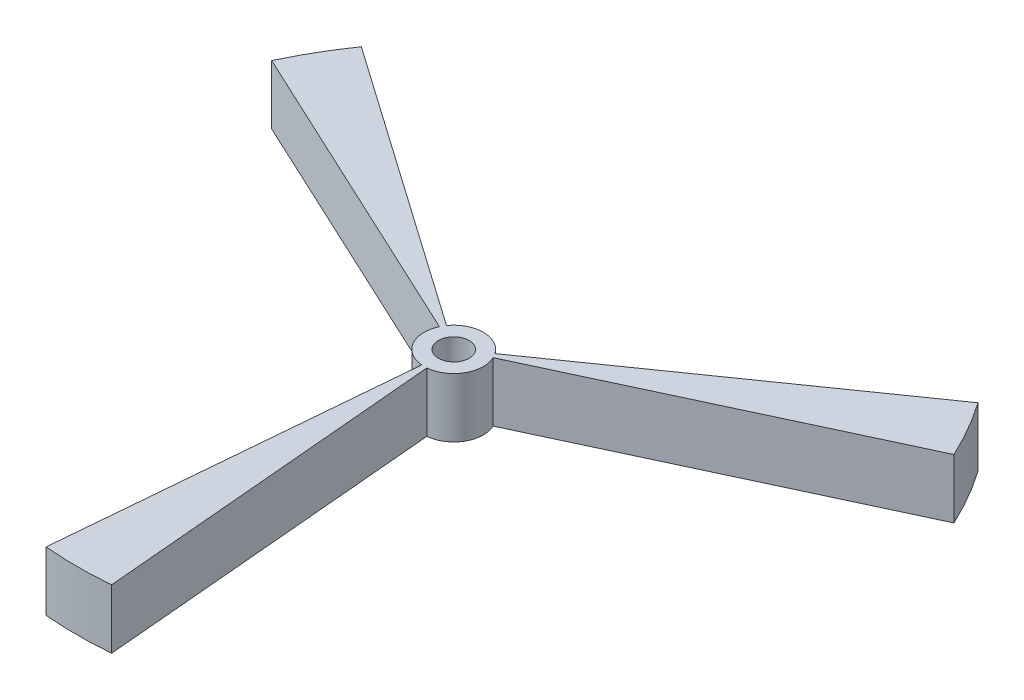
from build123d import *

# Parameters (mm, degrees)
SKETCH1_R           = 63.5
SKETCH1_R_2         = 2.6
BOSS_EXTRUDE1_DEPTH = 10
CUT_EXTRUDE1_START  = -10
CUT_EXTRUDE1_DEPTH  = 10


with BuildPart() as part:
    # Sketch1 → Boss-Extrude1 (new body)
    with BuildSketch(Plane(origin=(0, 0, 0), x_dir=(1, 0, 0), z_dir=(0, 1, 0))):
        with Locations(Location((0, 0, 0), (0, 0, 270))):
            Circle(SKETCH1_R)
        with Locations(Location((0, 0, 0), (0, 0, 270))):
            Circle(SKETCH1_R_2, mode=Mode.SUBTRACT)
    extrude(amount=BOSS_EXTRUDE1_DEPTH)

    # Sketch2 → Cut-Extrude1 (cut)
    with BuildSketch(Plane(origin=(0, 10, 0), x_dir=(1, 0, 0), z_dir=(0, 1, 0)).offset(CUT_EXTRUDE1_START)):
        with BuildLine():
            ThreePointArc((4.531538935, 2.113091309), (4.330127019, -2.5), (0.435778714, -4.98097349))
            Line((0.435778714, -4.98097349), (5.534389664, -63.258363329))
            ThreePointArc((5.534389664, -63.258363329), (54.99261314, -31.75), (57.550544477, 26.836259621))
            Line((57.550544477, 26.836259621), (4.531538935, 2.113091309))
        make_face()
        with BuildLine():
            Line((-5.534389664, -63.258363329), (-0.435778714, -4.98097349))
            ThreePointArc((-0.435778714, -4.98097349), (-4.330127019, -2.5), (-4.531538935, 2.113091309))
            Line((-4.531538935, 2.113091309), (-57.550544477, 26.836259621))
            ThreePointArc((-57.550544477, 26.836259621), (-54.99261314, -31.75), (-5.534389664, -63.258363329))
        make_face()
        with BuildLine():
            Line((-52.016154812, 36.422103708), (-4.095760221, 2.867882182))
            ThreePointArc((-4.095760221, 2.867882182), (0, 5), (4.095760221, 2.867882182))
            Line((4.095760221, 2.867882182), (52.016154812, 36.422103708))
            ThreePointArc((52.016154812, 36.422103708), (0, 63.5), (-52.016154812, 36.422103708))
        make_face()
    extrude(amount=CUT_EXTRUDE1_DEPTH, mode=Mode.SUBTRACT)


solid = part.part
